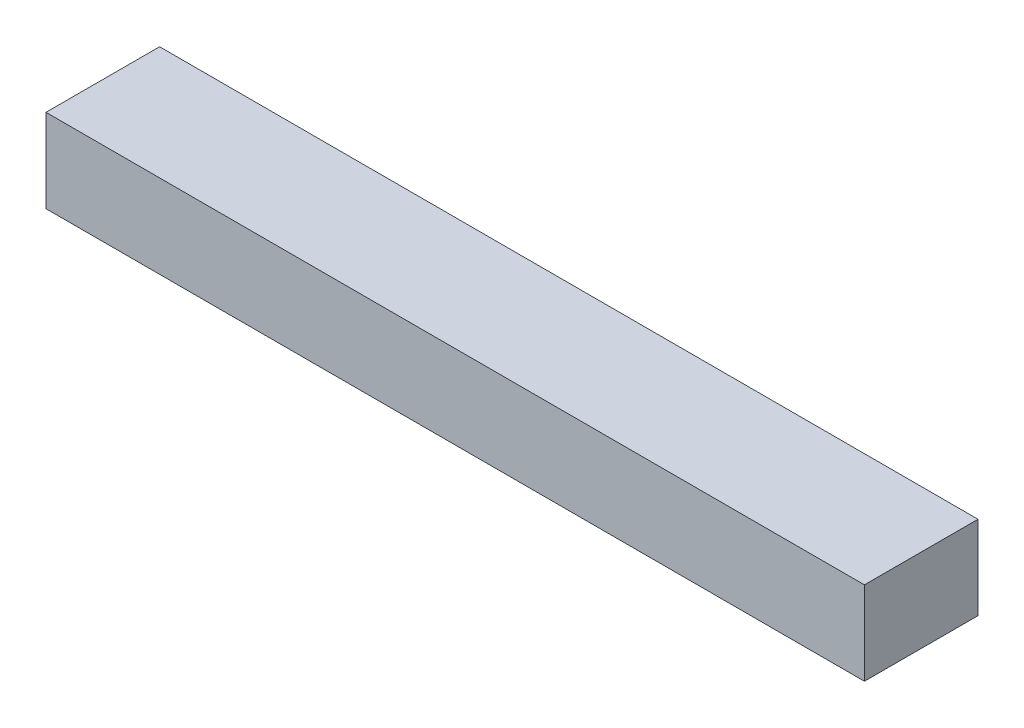
from build123d import *

# Parameters (mm, degrees)
SKETCH1_W           = 49
SKETCH1_H           = 6.8
BOSS_EXTRUDE1_DEPTH = 5


with BuildPart() as part:
    # Sketch1 → Boss-Extrude1 (new body)
    with BuildSketch(Plane(origin=(0, 0, 0), x_dir=(1, 0, 0), z_dir=(0, 1, 0))):
        with Locations((-48.176775234, 3.113292434)):
            Rectangle(SKETCH1_W, SKETCH1_H)
    extrude(amount=BOSS_EXTRUDE1_DEPTH)


solid = part.part
